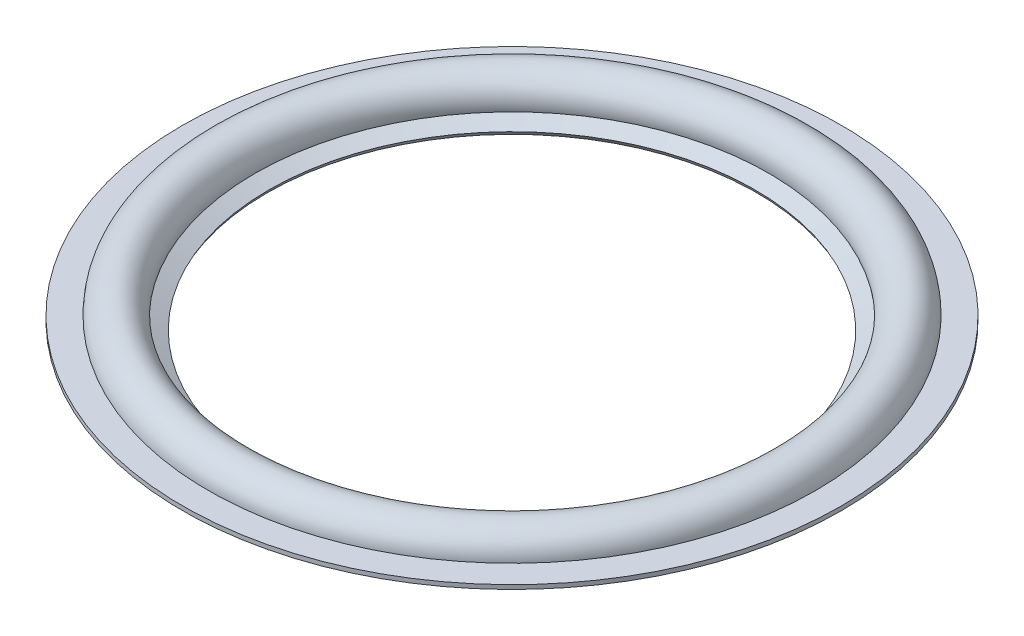
from build123d import *

# Parameters (mm, degrees)
FILLET_1_R = 0.5


with BuildPart() as part:
    # Эскиз1 → Повернуть1 (revolve)
    with BuildSketch(Plane.XY):
        with BuildLine():
            Line((-63, 0), (-58, 0))
            ThreePointArc((-58, 0), (-52.996844891, 4.471782076), (-49.112517806, -1))
            Line((-49.112517806, -1), (-46.463675028, -2.408414688))
            Line((-46.463675028, -2.408414688), (-46.839252278, -3.114772763))
            Line((-46.839252278, -3.114772763), (-50.07316247, -1.395272212))
            ThreePointArc((-50.07316247, -1.395272212), (-53.188226232, 3.686841076), (-57.112478374, -0.8))
            Line((-57.112478374, -0.8), (-63, -0.8))
            Line((-63, -0.8), (-63, 0))
        make_face()
    revolve(axis=Axis((0, 0, 0), (0, -1, 0)))

    # Скругление1
    fillet_1_edges = [part.edges().sort_by_distance(p)[0] for p in [
        (57.112478374, -0.8, 0),
        (50.07316247, -1.395272212, 0),
    ]]
    fillet(fillet_1_edges, radius=FILLET_1_R)


solid = part.part
